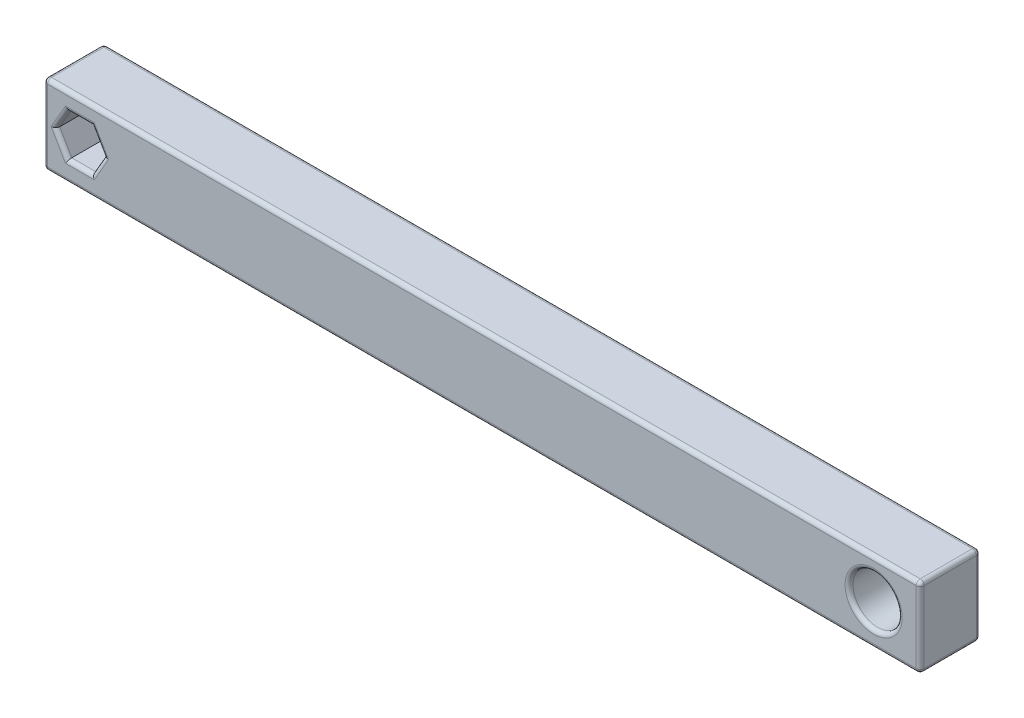
from build123d import *

# Parameters (mm, degrees)
SKETCH1_W           = 558.8
SKETCH1_H           = 50.8
SKETCH1_R           = 15.661500759
BOSS_EXTRUDE1_DEPTH = 38.354
FILLET2_R           = 2.54
FILLET3_R           = 2.54
FILLET4_R           = 2.54
FILLET5_R           = 2.54
FILLET6_R           = 2.54
FILLET7_R           = 2.54
FILLET8_R           = 2.54
FILLET9_R           = 2.54


with BuildPart() as part:
    # Sketch1 → Boss-Extrude1 (new body)
    with BuildSketch(Plane.XY):
        with Locations((250.222913627, 20.811022444)):
            Rectangle(SKETCH1_W, SKETCH1_H)
        with Locations((499.940155303, 21.505918387)):
            Circle(SKETCH1_R, mode=Mode.SUBTRACT)
        Polygon((9.266544067, 21.505918387), (1.58198055, 34.815972833), (-13.787146484, 34.815972833), (-21.471710001, 21.505918387), (-13.787146484, 8.195863942), (1.58198055, 8.195863942), align=None, mode=Mode.SUBTRACT)
    extrude(amount=BOSS_EXTRUDE1_DEPTH)

    # Fillet2
    fillet2_edges = [part.edges().sort_by_distance(p)[0] for p in [
        (-29.177086373, 46.211022444, 19.177),
    ]]
    fillet(fillet2_edges, radius=FILLET2_R)

    # Fillet3
    fillet3_edges = [part.edges().sort_by_distance(p)[0] for p in [
        (251.492913627, 46.211022444, 38.354),
        (-29.177086373, 19.541022444, 38.354),
        (-28.433137597, 45.467073669, 38.354),
    ]]
    fillet(fillet3_edges, radius=FILLET3_R)

    # Fillet4
    fillet4_edges = [part.edges().sort_by_distance(p)[0] for p in [
        (-29.177086373, 19.541022444, 0),
        (-28.433137597, 45.467073669, 0),
        (251.492913627, 46.211022444, 0),
    ]]
    fillet(fillet4_edges, radius=FILLET4_R)

    # Fillet5
    fillet5_edges = [part.edges().sort_by_distance(p)[0] for p in [
        (529.622913627, 19.541022444, 38.354),
        (529.622913627, 46.211022444, 19.177),
        (529.622913627, 45.467073669, 37.610051224),
        (529.622913627, 19.541022444, 0),
        (529.622913627, 45.467073669, 0.743948776),
    ]]
    fillet(fillet5_edges, radius=FILLET5_R)

    # Fillet6
    fillet6_edges = [part.edges().sort_by_distance(p)[0] for p in [
        (250.222913627, -4.588977556, 38.354),
        (-29.177086373, -4.588977556, 19.177),
        (-28.433137597, -4.588977556, 37.610051224),
        (250.222913627, -4.588977556, 0),
        (-28.433137597, -4.588977556, 0.743948776),
        (529.622913627, -4.588977556, 19.177),
        (528.878964852, -4.588977556, 37.610051224),
        (528.878964852, -4.588977556, 0.743948776),
    ]]
    fillet(fillet6_edges, radius=FILLET6_R)

    # Fillet7
    fillet7_edges = [part.edges().sort_by_distance(p)[0] for p in [
        (484.278654543, 21.505918387, 0),
        (484.278654543, 21.505918387, 38.354),
    ]]
    fillet(fillet7_edges, radius=FILLET7_R)

    # Fillet8
    fillet8_edges = [part.edges().sort_by_distance(p)[0] for p in [
        (5.424262309, 14.850891165, 0),
        (5.424262309, 28.16094561, 0),
        (-6.102582967, 34.815972833, 0),
        (-17.629428242, 28.16094561, 0),
        (-17.629428242, 14.850891165, 0),
        (-6.102582967, 8.195863942, 0),
    ]]
    fillet(fillet8_edges, radius=FILLET8_R)

    # Fillet9
    fillet9_edges = [part.edges().sort_by_distance(p)[0] for p in [
        (5.424262309, 14.850891165, 38.354),
        (5.424262309, 28.16094561, 38.354),
        (-6.102582967, 34.815972833, 38.354),
        (-17.629428242, 28.16094561, 38.354),
        (-17.629428242, 14.850891165, 38.354),
        (-6.102582967, 8.195863942, 38.354),
    ]]
    fillet(fillet9_edges, radius=FILLET9_R)


solid = part.part
